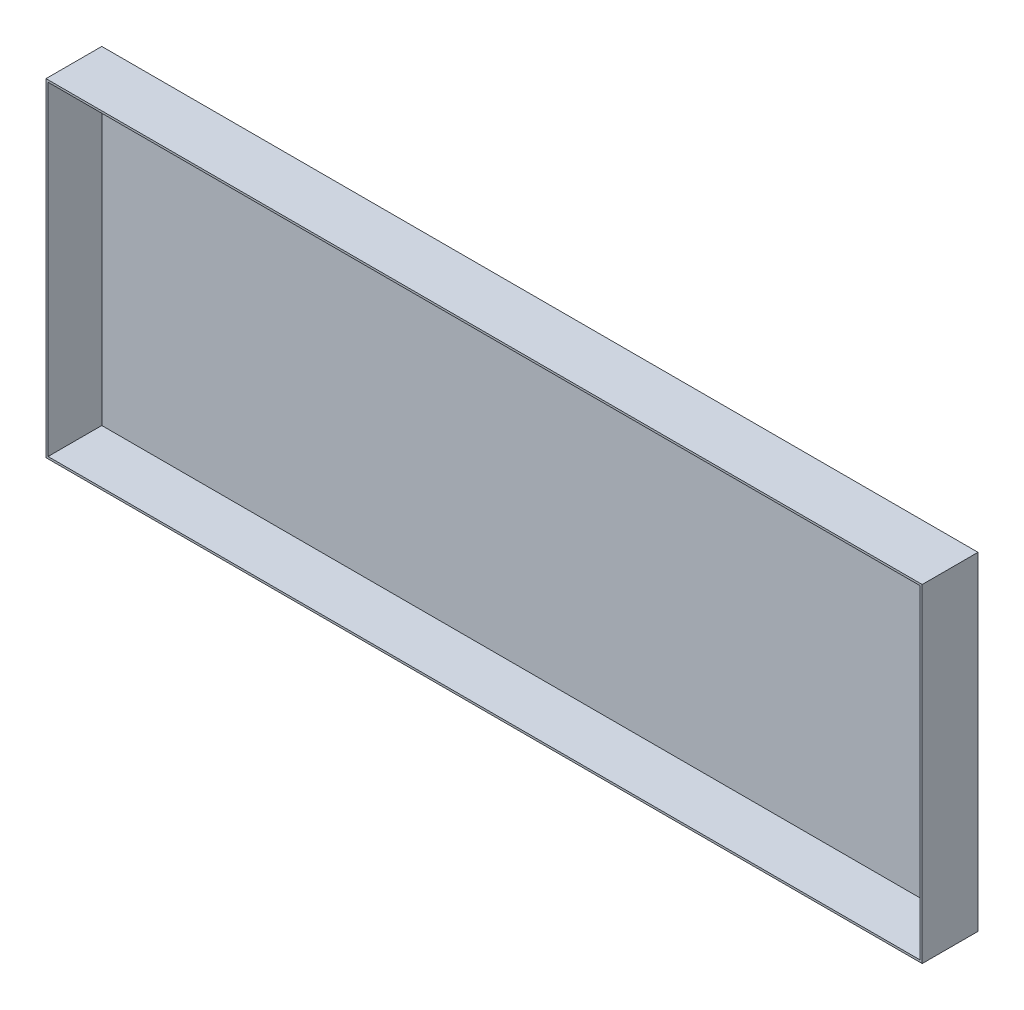
from build123d import *

# Parameters (mm, degrees)
CROQUIS1_W              = 798
CROQUIS1_H              = 299
SALIENTE_EXTRUIR1_DEPTH = 50.8
VACIADO1_T              = -1.9


with BuildPart() as part:
    # Croquis1 → Saliente-Extruir1 (new body)
    with BuildSketch(Plane.XY):
        Rectangle(CROQUIS1_W, CROQUIS1_H)
    extrude(amount=SALIENTE_EXTRUIR1_DEPTH)

    # Vaciado1
    vaciado1_openings = [part.faces().sort_by_distance(p)[0] for p in [
        (0, 0, 50.8),
    ]]
    offset(amount=VACIADO1_T, openings=vaciado1_openings, kind=Kind.INTERSECTION)


solid = part.part
